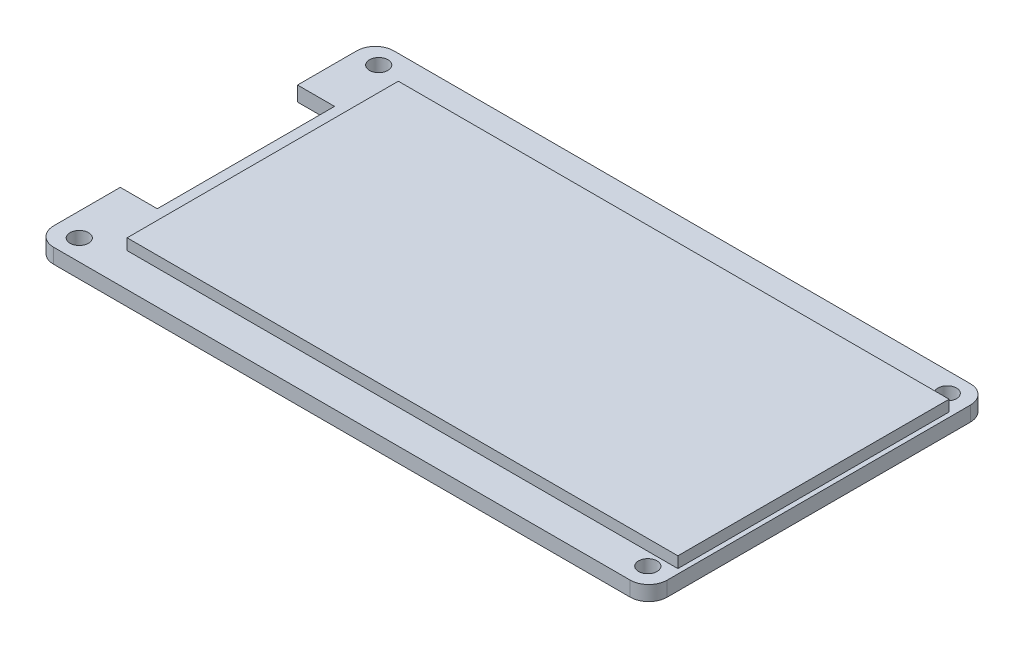
from build123d import *

# Parameters (mm, degrees)
SKETCH1_R           = 1
BOSS_EXTRUDE1_DEPTH = 1.6
SKETCH2_W           = 59.5
SKETCH2_H           = 29.3
BOSS_EXTRUDE2_DEPTH = 1.2


with BuildPart() as part:
    # Sketch1 → Boss-Extrude1 (new body)
    with BuildSketch(Plane(origin=(0, 0, 0), x_dir=(1, 0, 0), z_dir=(0, 1, 0))):
        with BuildLine():
            Line((-33.145, -9.175), (-33.145, -16.375))
            ThreePointArc((-33.145, -16.375), (-32.559213562, -17.789213562), (-31.145, -18.375))
            Line((-31.145, -18.375), (31.145, -18.375))
            ThreePointArc((31.145, -18.375), (32.559213562, -17.789213562), (33.145, -16.375))
            Line((33.145, -16.375), (33.145, 16.375))
            ThreePointArc((33.145, 16.375), (32.559213562, 17.789213562), (31.145, 18.375))
            Line((31.145, 18.375), (-31.145, 18.375))
            ThreePointArc((-31.145, 18.375), (-32.559213562, 17.789213562), (-33.145, 16.375))
            Line((-33.145, 16.375), (-33.145, 9.975))
            Line((-33.145, 9.975), (-29.145, 9.975))
            Line((-29.145, 9.975), (-29.145, -9.175))
            Line((-29.145, -9.175), (-33.145, -9.175))
        make_face()
        with Locations(Location((-30.625, -16.125, 0), (0, 0, 270))):
            Circle(SKETCH1_R, mode=Mode.SUBTRACT)
        with Locations(Location((30.795, -16.125, 0), (0, 0, 270))):
            Circle(SKETCH1_R, mode=Mode.SUBTRACT)
        with Locations(Location((30.795, 16.225, 0), (0, 0, 270))):
            Circle(SKETCH1_R, mode=Mode.SUBTRACT)
        with Locations(Location((-30.625, 16.225, 0), (0, 0, 270))):
            Circle(SKETCH1_R, mode=Mode.SUBTRACT)
    extrude(amount=BOSS_EXTRUDE1_DEPTH)

    # Sketch2 → Boss-Extrude2 (add)
    with BuildSketch(Plane(origin=(0, 1.6, 0), x_dir=(1, 0, 0), z_dir=(0, 1, 0))):
        with Locations((2.895, -0.075)):
            Rectangle(SKETCH2_W, SKETCH2_H)
    extrude(amount=BOSS_EXTRUDE2_DEPTH)


solid = part.part
